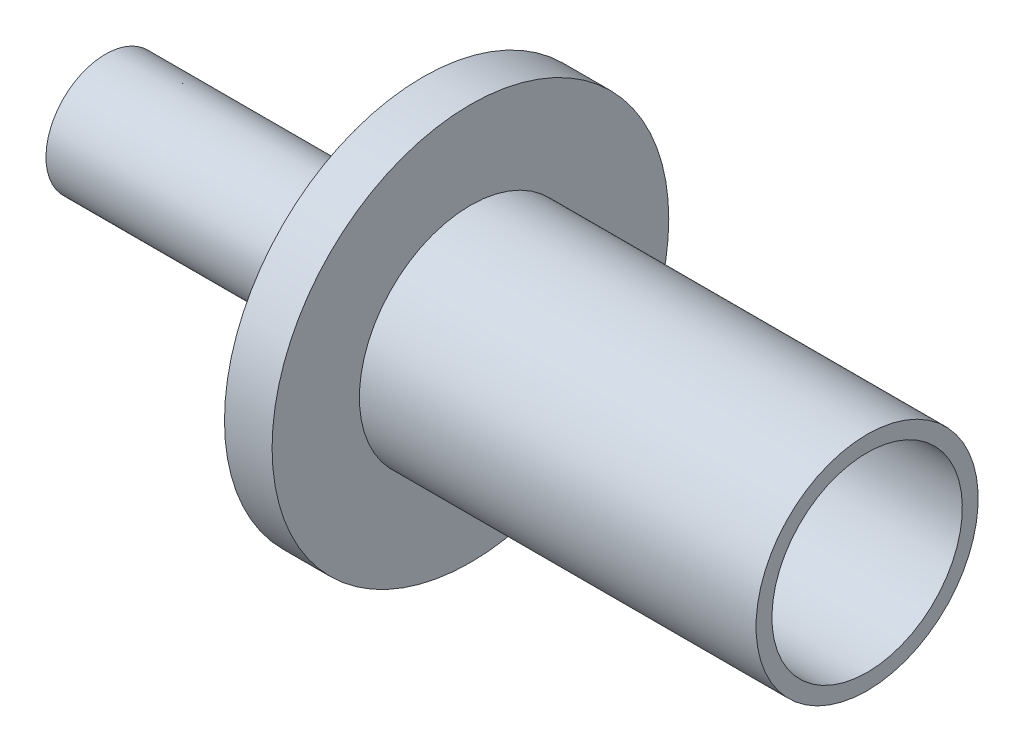
from build123d import *

# Parameters (mm, degrees)
CUT_EXTRUDE1_REACH = 68.227
SKETCH4_W          = 8
SKETCH4_H          = 13


with BuildPart() as part:
    # Sketch1 → Revolve1 (revolve)
    with BuildSketch(Plane.XY, mode=Mode.PRIVATE) as revolve1_sk:
        Polygon((0, 25), (0, 7.5), (-40, 7.5), (-40, 6.5), (19, 6.5), (19, 12), (56, 12), (56, 14), (6, 14), (6, 25), align=None)
    revolve(revolve1_sk.sketch.rotate(Axis((-64.900117457, 0, 0), (1, 0, 0)), 180), axis=Axis((-64.900117457, 0, 0), (1, 0, 0)))

    # Sketch4 → Cut-Extrude1 (cut, up to next)
    with BuildSketch(Plane(origin=(0, 0, 0), x_dir=(1, 0, 0), z_dir=(0, 1, 0)), mode=Mode.PRIVATE) as cut_extrude1_sk1:
        with Locations((15, 0)):
            Rectangle(SKETCH4_W, SKETCH4_H)
    cut_extrude1_tool1 = extrude(cut_extrude1_sk1.sketch, amount=-CUT_EXTRUDE1_REACH, mode=Mode.PRIVATE) & part.part
    add(cut_extrude1_tool1.solids().sort_by_distance((15, 0, 0))[0], mode=Mode.SUBTRACT)


solid = part.part
